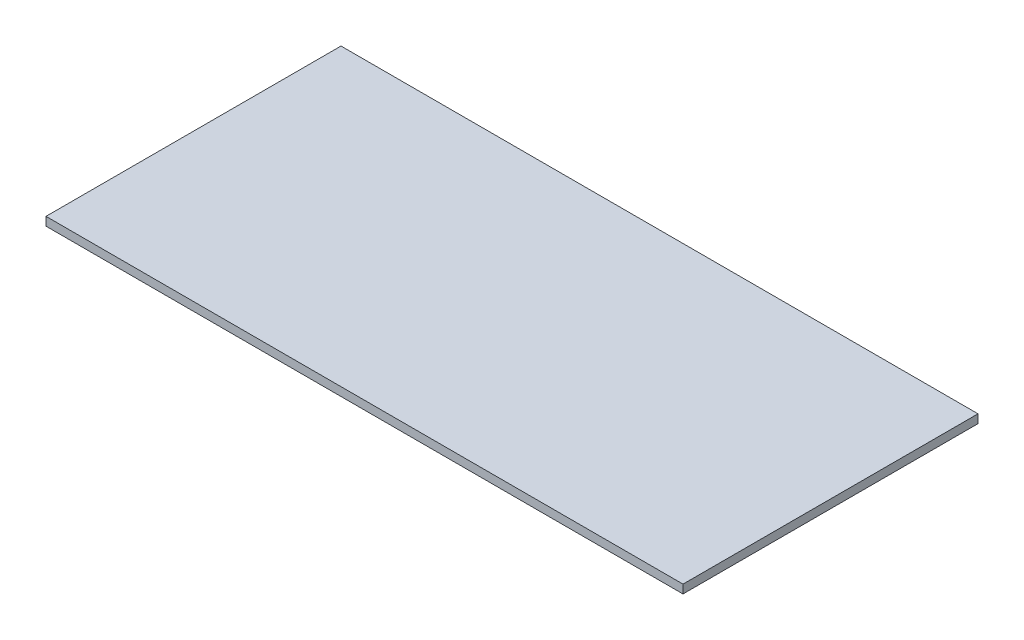
from build123d import *

# Parameters (mm, degrees)
SKETCH1_W           = 189.23
SKETCH1_H           = 87.63
BOSS_EXTRUDE1_DEPTH = 2.54


with BuildPart() as part:
    # Sketch1 → Boss-Extrude1 (new body)
    with BuildSketch(Plane(origin=(0, 0, 0), x_dir=(1, 0, 0), z_dir=(0, 1, 0))):
        Rectangle(SKETCH1_W, SKETCH1_H)
    extrude(amount=BOSS_EXTRUDE1_DEPTH)


solid = part.part
